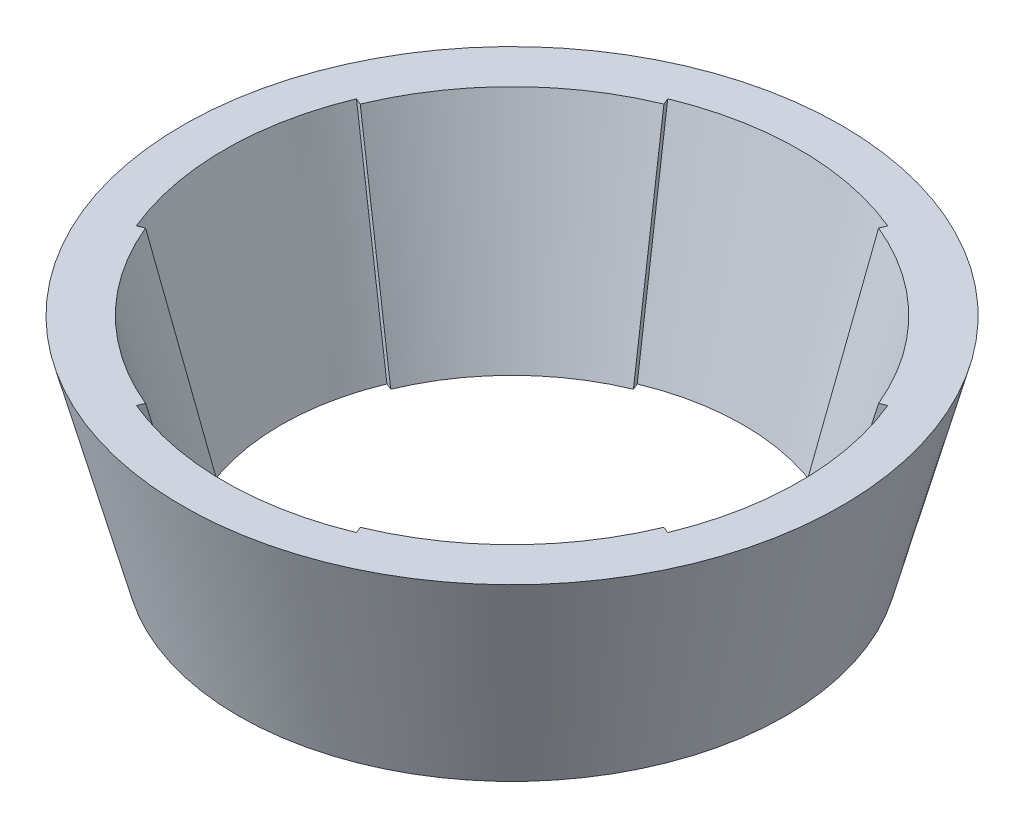
from build123d import *

# Parameters (mm, degrees)
CUT_REVOLVE1_ANGLE = 45
CIRPATTERN1_COUNT  = 4


with BuildPart() as part:
    # Sketch1 → Revolve1 (revolve)
    with BuildSketch(Plane.XY, mode=Mode.PRIVATE) as revolve1_sk:
        Polygon((40.64, 0), (50.848864232, 38.1), (59.738864232, 38.1), (49.53, 0), align=None)
    revolve(revolve1_sk.sketch.rotate(Axis((0, 0, 0), (0, 1, 0)), 90), axis=Axis((0, 0, 0), (0, 1, 0)))

    # Sketch2 → Cut-Revolve1 (revolve, symmetric, cut)
    with BuildSketch(Plane.XY) as cut_revolve1_sk:
        Polygon((50.848864232, 38.1), (40.64, 0), (41.91, 0), (52.118864232, 38.1), align=None)
    cut_revolve1 = revolve(axis=Axis((0, 0, 0), (0, 1, 0)), revolution_arc=CUT_REVOLVE1_ANGLE / 2, mode=Mode.SUBTRACT)
    cut_revolve1 = cut_revolve1 + revolve(cut_revolve1_sk.sketch, axis=Axis((0, 0, 0), (0, -1, 0)), revolution_arc=CUT_REVOLVE1_ANGLE / 2, mode=Mode.SUBTRACT)

    # CirPattern1: Cut-Revolve1 ×4 about axis
    cirpattern1_axis = Axis((0, 38.1, 0), (0, -1, 0))
    for i in range(1, CIRPATTERN1_COUNT):
        add(cut_revolve1.rotate(cirpattern1_axis, i * 360 / CIRPATTERN1_COUNT), mode=Mode.SUBTRACT)


solid = part.part
